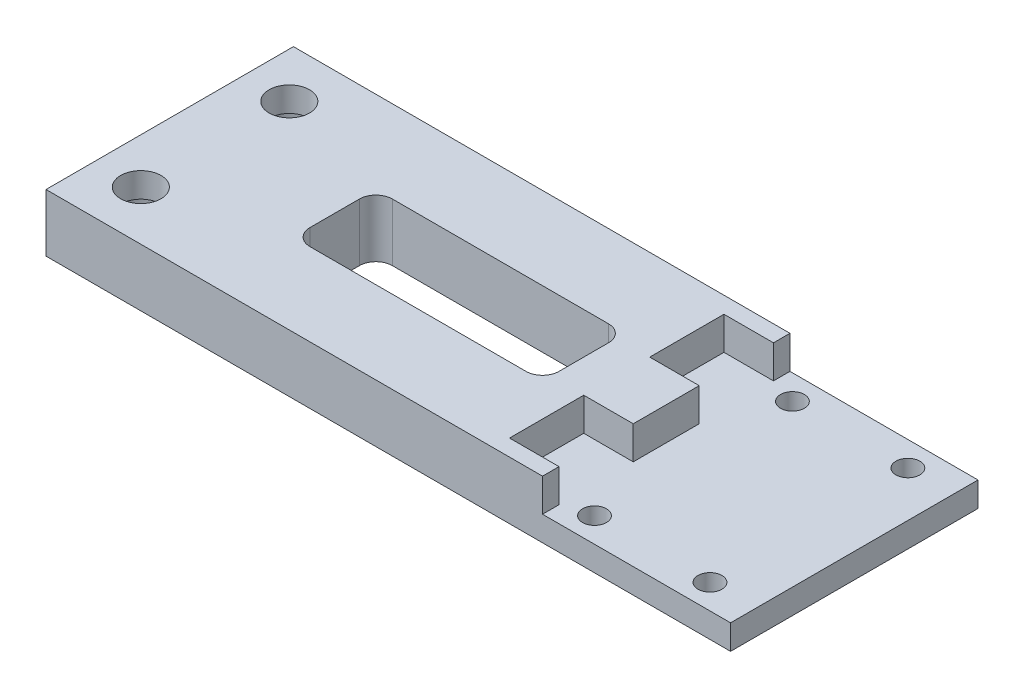
from build123d import *

# Parameters (mm, degrees)
SKETCH_1_W           = 88
SKETCH_1_H           = 30
EXTRUDE_1_DEPTH      = 3
SKETCH_2_W           = 27.8
SKETCH_2_H           = 30
CUT_EXTRUDE_1_DEPTH  = 1
SKETCH_3_R           = 1.45
CUT_EXTRUDE_2_DEPTH  = 11
SKETCH_4_R           = 2.45
CUT_EXTRUDE_4_DEPTH  = 11
SKETCH_5_W           = 30.2
SKETCH_5_H           = 10
CUT_EXTRUDE_5_DEPTH  = 11
FILLET_1_R           = 2
SKETCH_6_W           = 5
SKETCH_6_H           = 30
CUT_EXTRUDE_6_DEPTH  = 10
SKETCH_9_W           = 60.2
SKETCH_9_H           = 30
SKETCH_9_R           = 2.45
EXTRUDE_4_DEPTH      = 4
EXTRUDE_START        = 1
SKETCH_7_W           = 22.8
SKETCH_7_H           = 30
SKETCH_7_R           = 1.45
EXTRUDE_5_DEPTH      = 1
SKETCH_11_W          = 15
SKETCH_11_H          = 4
CUT_EXTRUDE_8_DEPTH  = 6
SKETCH_12_W          = 2
SKETCH_12_H          = 4
EXTRUDE_6_DEPTH      = 6
SKETCH_13_W          = 6
SKETCH_13_H          = 4
EXTRUDE_7_DEPTH      = 4
SKETCH_14_R          = 4
CUT_EXTRUDE_9_DEPTH  = 4
SKETCH_15_W          = 9
SKETCH_15_H          = 4
CUT_EXTRUDE_10_DEPTH = 6


with BuildPart() as part:
    # 草图1 → 凸台-拉伸1 (new body)
    with BuildSketch(Plane(origin=(0, 0, 0), x_dir=(1, 0, 0), z_dir=(0, 1, 0))):
        with Locations((-44, 15)):
            Rectangle(SKETCH_1_W, SKETCH_1_H)
    extrude(amount=EXTRUDE_1_DEPTH)

    # 草图2 → 切除-拉伸1 (cut)
    with BuildSketch(Plane(origin=(0, 3, 0), x_dir=(1, 0, 0), z_dir=(0, 1, 0))):
        with Locations((-13.9, 15)):
            Rectangle(SKETCH_2_W, SKETCH_2_H)
    extrude(amount=-CUT_EXTRUDE_1_DEPTH, mode=Mode.SUBTRACT)

    # 草图3 → 切除-拉伸2 (cut)
    with BuildSketch(Plane(origin=(0, 2, 0), x_dir=(1, 0, 0), z_dir=(0, 1, 0))):
        with Locations(Location((-24.5, 27, 0), (0, 0, 270))):
            Circle(SKETCH_3_R)
        with Locations(Location((-24.5, 3, 0), (0, 0, 270))):
            Circle(SKETCH_3_R)
        with Locations(Location((-10.5, 3, 0), (0, 0, 270))):
            Circle(SKETCH_3_R)
        with Locations(Location((-10.5, 27, 0), (0, 0, 270))):
            Circle(SKETCH_3_R)
    extrude(amount=-CUT_EXTRUDE_2_DEPTH, mode=Mode.SUBTRACT)

    # 草图4 → 切除-拉伸4 (cut)
    with BuildSketch(Plane(origin=(0, 3, 0), x_dir=(1, 0, 0), z_dir=(0, 1, 0))):
        with Locations(Location((-82.5, 24, 0), (0, 0, 270))):
            Circle(SKETCH_4_R)
        with Locations(Location((-82.5, 6, 0), (0, 0, 270))):
            Circle(SKETCH_4_R)
    extrude(amount=-CUT_EXTRUDE_4_DEPTH, mode=Mode.SUBTRACT)

    # 草图5 → 切除-拉伸5 (cut)
    with BuildSketch(Plane(origin=(0, 3, 0), x_dir=(1, 0, 0), z_dir=(0, 1, 0))):
        with Locations((-52.9, 15)):
            Rectangle(SKETCH_5_W, SKETCH_5_H)
    extrude(amount=-CUT_EXTRUDE_5_DEPTH, mode=Mode.SUBTRACT)

    # 圆角1
    fillet_1_edges = [part.edges().sort_by_distance(p)[0] for p in [
        (-68, 1.5, -10),
        (-68, 1.5, -20),
        (-37.8, 1.5, -20),
        (-37.8, 1.5, -10),
    ]]
    fillet(fillet_1_edges, radius=FILLET_1_R)

    # 草图6 → 切除-拉伸6 (cut)
    with BuildSketch(Plane.XZ):
        with Locations((-2.5, -15)):
            Rectangle(SKETCH_6_W, SKETCH_6_H)
    extrude(amount=-CUT_EXTRUDE_6_DEPTH, mode=Mode.SUBTRACT)

    # 草图9 → 凸台-拉伸4 (add)
    with BuildSketch(Plane(origin=(0, 3, 0), x_dir=(1, 0, 0), z_dir=(0, 1, 0))):
        with Locations((-57.9, 15)):
            Rectangle(SKETCH_9_W, SKETCH_9_H)
        with Locations(Location((-82.5, 6, 0), (0, 0, 270))):
            Circle(SKETCH_9_R, mode=Mode.SUBTRACT)
        with Locations(Location((-82.5, 24, 0), (0, 0, 270))):
            Circle(SKETCH_9_R, mode=Mode.SUBTRACT)
        with BuildLine():
            Line((-37.8, 12), (-37.8, 18))
            ThreePointArc((-37.8, 18), (-38.385786438, 19.414213562), (-39.8, 20))
            Line((-39.8, 20), (-66, 20))
            ThreePointArc((-66, 20), (-67.414213562, 19.414213562), (-68, 18))
            Line((-68, 18), (-68, 12))
            ThreePointArc((-68, 12), (-67.414213562, 10.585786438), (-66, 10))
            Line((-66, 10), (-39.8, 10))
            ThreePointArc((-39.8, 10), (-38.385786438, 10.585786438), (-37.8, 12))
        make_face(mode=Mode.SUBTRACT)
    extrude(amount=EXTRUDE_4_DEPTH)

    # 草图7 → 凸台-拉伸5 (add)
    with BuildSketch(Plane(origin=(0, 2, 0), x_dir=(1, 0, 0), z_dir=(0, 1, 0)).offset(EXTRUDE_START)):
        with Locations((-16.4, 15)):
            Rectangle(SKETCH_7_W, SKETCH_7_H)
        with Locations(Location((-10.5, 3, 0), (0, 0, 270))):
            Circle(SKETCH_7_R, mode=Mode.SUBTRACT)
        with Locations(Location((-24.5, 27, 0), (0, 0, 270))):
            Circle(SKETCH_7_R, mode=Mode.SUBTRACT)
        with Locations(Location((-10.5, 27, 0), (0, 0, 270))):
            Circle(SKETCH_7_R, mode=Mode.SUBTRACT)
        with Locations(Location((-24.5, 3, 0), (0, 0, 270))):
            Circle(SKETCH_7_R, mode=Mode.SUBTRACT)
    extrude(amount=-EXTRUDE_5_DEPTH)

    # 草图11 → 切除-拉伸8 (cut)
    with BuildSketch(Plane(origin=(-27.8, 0, 0), x_dir=(0, 0, -1), z_dir=(1, 0, 0))):
        with Locations((22.5, 5)):
            Rectangle(SKETCH_11_W, SKETCH_11_H)
    extrude(amount=-CUT_EXTRUDE_8_DEPTH, mode=Mode.SUBTRACT)

    # 草图12 → 凸台-拉伸6 (add)
    with BuildSketch(Plane(origin=(-33.8, 0, 0), x_dir=(0, 0, -1), z_dir=(1, 0, 0))):
        with Locations((29, 5)):
            Rectangle(SKETCH_12_W, SKETCH_12_H)
    extrude(amount=EXTRUDE_6_DEPTH)

    # 草图13 → 凸台-拉伸7 (add)
    with BuildSketch(Plane(origin=(0, 0, -15), x_dir=(-1, 0, 0), z_dir=(0, 0, -1))):
        with Locations((30.8, 5)):
            Rectangle(SKETCH_13_W, SKETCH_13_H)
    extrude(amount=EXTRUDE_7_DEPTH)

    # 草图14 → 切除-拉伸9 (cut)
    with BuildSketch(Plane.XZ):
        with Locations(Location((-82.5, -6, 0), (0, 0, 270))):
            Circle(SKETCH_14_R)
        with Locations(Location((-82.5, -24, 0), (0, 0, 270))):
            Circle(SKETCH_14_R)
    extrude(amount=-CUT_EXTRUDE_9_DEPTH, mode=Mode.SUBTRACT)

    # 草图15 → 切除-拉伸10 (cut)
    with BuildSketch(Plane(origin=(-27.8, 0, 0), x_dir=(0, 0, -1), z_dir=(1, 0, 0))):
        with Locations((6.5, 5)):
            Rectangle(SKETCH_15_W, SKETCH_15_H)
    extrude(amount=-CUT_EXTRUDE_10_DEPTH, mode=Mode.SUBTRACT)


solid = part.part
